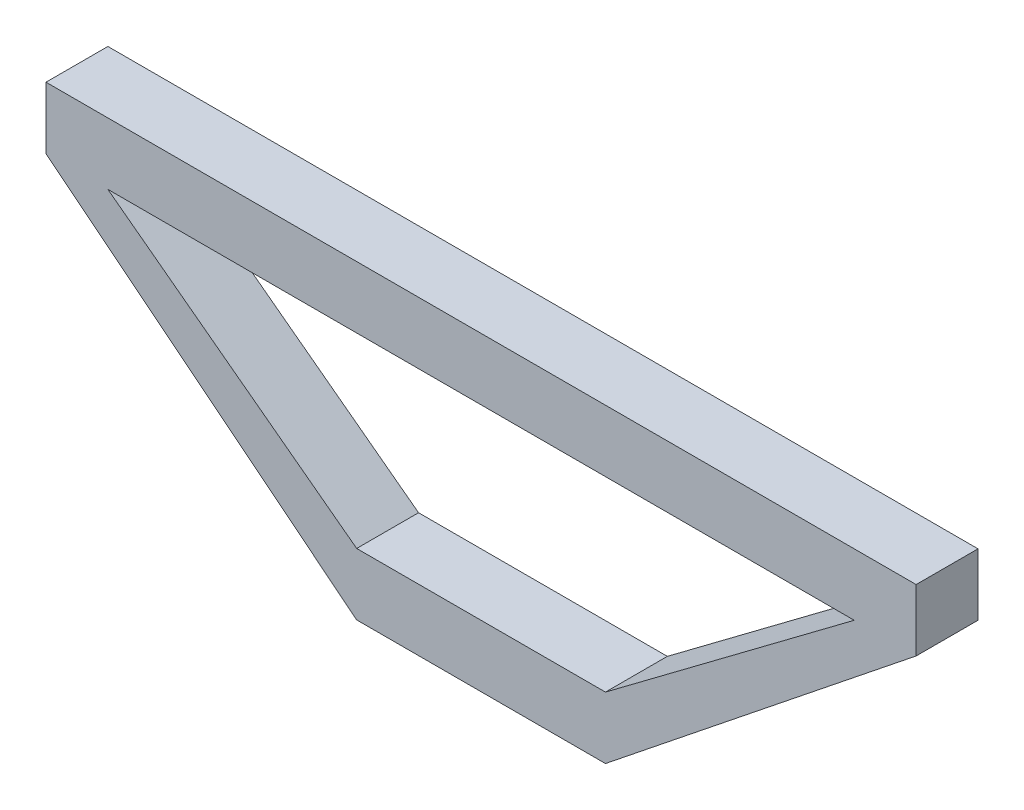
from build123d import *

# Parameters (mm, degrees)
BOSS_EXTRUDE3_DEPTH  = 99.5
SKETCH1_10_OUTSIDE_W = 1698.732
SKETCH1_10_OUTSIDE_H = 798.732
CUT_EXTRUDE2_DEPTH   = 990.242513239


with BuildPart() as part:
    # Sketch1 → Boss-Extrude3 (new body)
    with BuildSketch(Plane.XY):
        Polygon((-499.5, 399.5), (899.5, 399.5), (899.5, 300), (400, -99.5), (0, -99.5), (-499.5, 300), align=None)
    extrude(amount=BOSS_EXTRUDE3_DEPTH)

    # Sketch1<10> outside → Cut-Extrude2 (cut, through all)
    # profile 1 of 2: a face of its own
    with BuildSketch(Plane.XY):
        with Locations((200, 150)):
            Rectangle(SKETCH1_10_OUTSIDE_W, SKETCH1_10_OUTSIDE_H)
        Polygon((-499.5, 399.5), (899.5, 399.5), (899.5, 300), (400, -99.5), (0, -99.5), (-499.5, 300), align=None, mode=Mode.SUBTRACT)
    # profile 2 of 2: a face of its own
    with BuildSketch(Plane.XY):
        Polygon((0, 0), (400, 0), (800, 300), (-400, 300), align=None)
    extrude(amount=CUT_EXTRUDE2_DEPTH, mode=Mode.SUBTRACT)


solid = part.part
